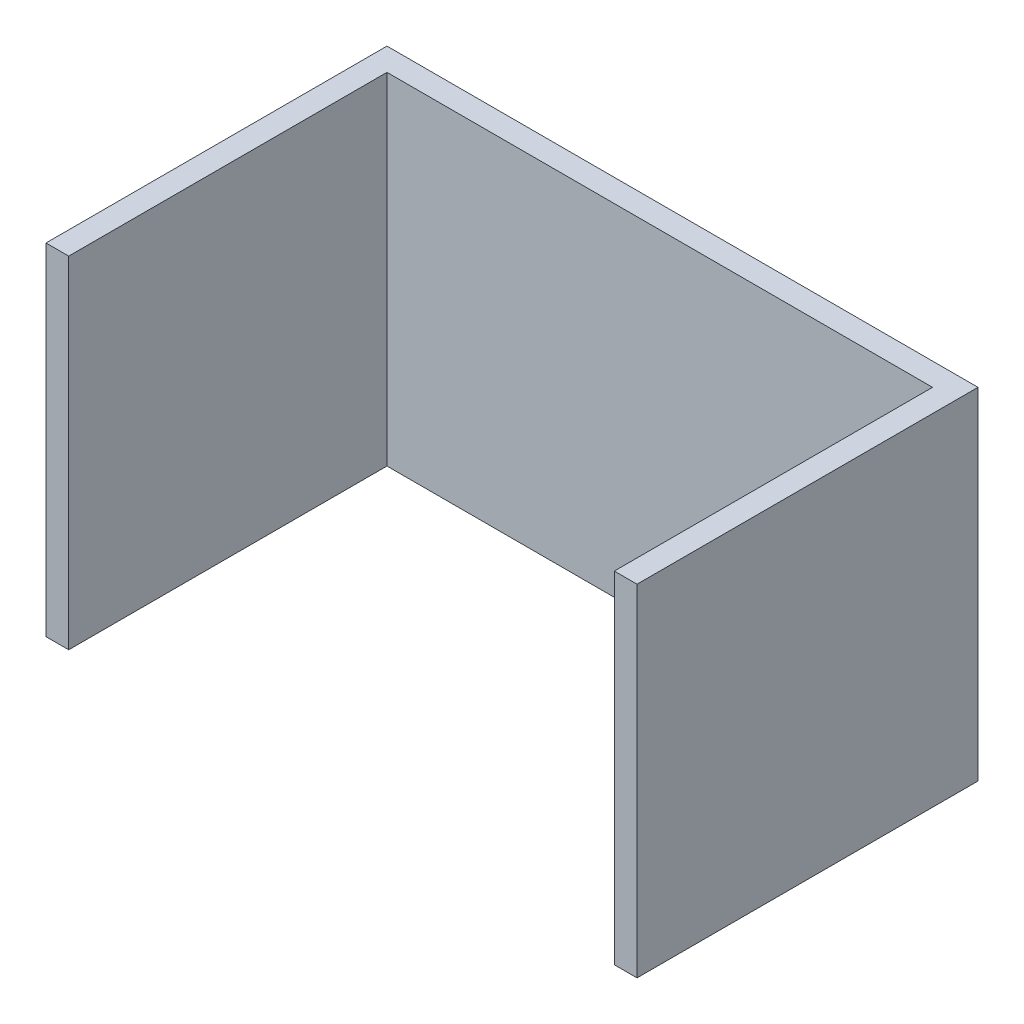
from build123d import *

# Parameters (mm, degrees)
ESQUISSE1_W             = 52
ESQUISSE1_H             = 30
BOSS_EXTRU_1_DEPTH      = 30
ESQUISSE2_W             = 48
ESQUISSE2_H             = 33.318107494
ENL_V_MAT_EXTRU_1_DEPTH = 47


with BuildPart() as part:
    # Esquisse1 → Boss.-Extru.1 (new body)
    with BuildSketch(Plane(origin=(0, 0, 0), x_dir=(1, 0, 0), z_dir=(0, 1, 0))):
        with Locations((14.422104904, 13.595972846)):
            Rectangle(ESQUISSE1_W, ESQUISSE1_H)
    extrude(amount=BOSS_EXTRU_1_DEPTH)

    # Esquisse2 → Enlèv. mat.-Extru.1 (cut)
    with BuildSketch(Plane(origin=(0, 30, 0), x_dir=(1, 0, 0), z_dir=(0, 1, 0))):
        with Locations((14.422104904, 9.936919099)):
            Rectangle(ESQUISSE2_W, ESQUISSE2_H)
    extrude(amount=-ENL_V_MAT_EXTRU_1_DEPTH, mode=Mode.SUBTRACT)


solid = part.part
